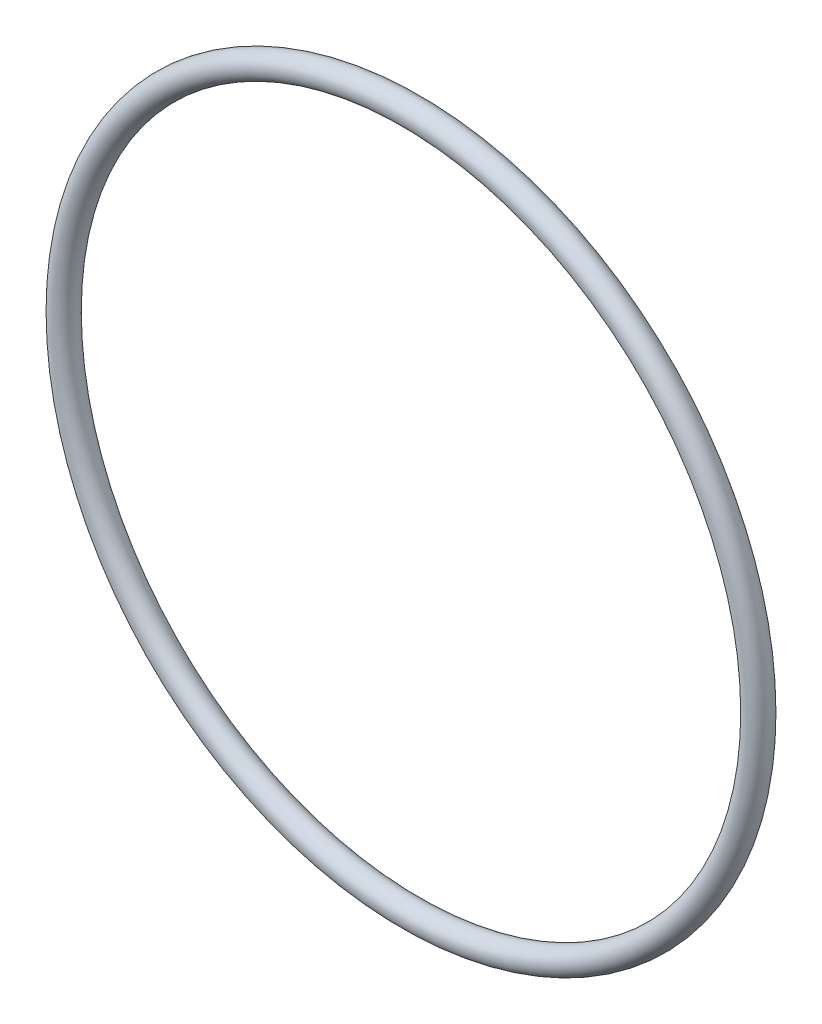
from build123d import *

# Parameters (mm, degrees)
SKETCH1_R = 1.7653


with BuildPart() as part:
    # Sketch1 → Revolve1 (revolve)
    with BuildSketch(Plane(origin=(0, 0, 0), x_dir=(0, -1, 0), z_dir=(1, 0, 0)), mode=Mode.PRIVATE) as revolve1_sk:
        with Locations((49.1871, 0)):
            Circle(SKETCH1_R)
    revolve(revolve1_sk.sketch.rotate(Axis((0, 0, 1.7653), (0, 0, -1)), 270), axis=Axis((0, 0, 1.7653), (0, 0, -1)))


solid = part.part
